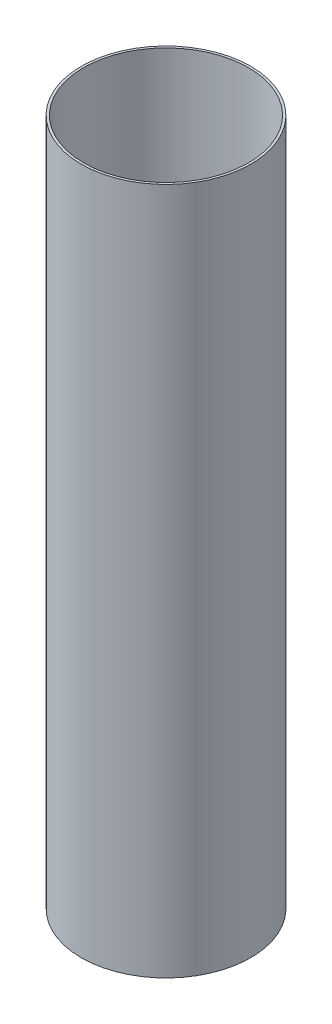
from build123d import *

# Parameters (mm, degrees)
SKETCH1_R           = 7.8359
SKETCH1_R_2         = 7.62
BOSS_EXTRUDE1_DEPTH = 63.5


with BuildPart() as part:
    # Sketch1 → Boss-Extrude1 (new body)
    with BuildSketch(Plane(origin=(0, 0, 0), x_dir=(1, 0, 0), z_dir=(0, 1, 0))):
        with Locations(Location((0, 0, 0), (0, 0, 270))):
            Circle(SKETCH1_R)
        with Locations(Location((0, 0, 0), (0, 0, 270))):
            Circle(SKETCH1_R_2, mode=Mode.SUBTRACT)
    extrude(amount=BOSS_EXTRUDE1_DEPTH)


solid = part.part
